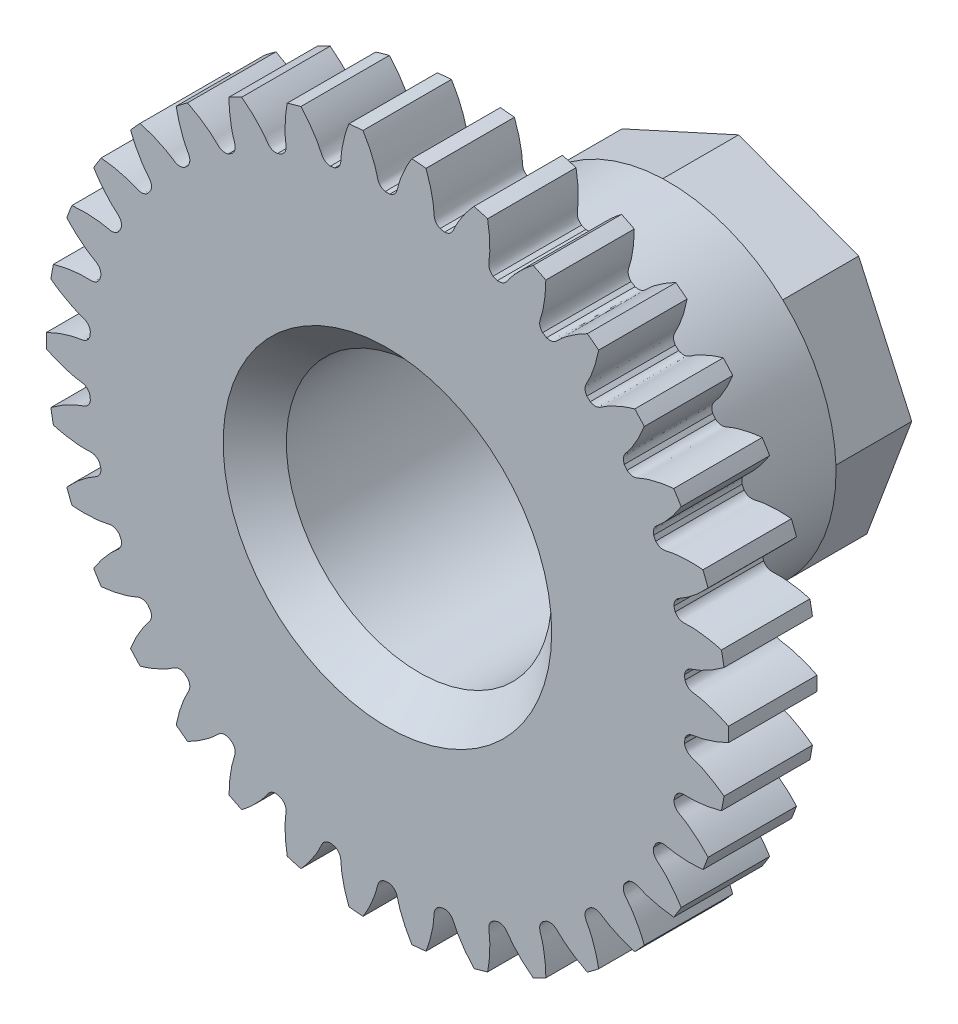
from build123d import *

# Parameters (mm, degrees)
SKETCH_1_R               = 27
EXTRUDE_1_DEPTH          = 7
CUT_EXTRUDE_1_DEPTH      = 39.820097888
PATTERN_CIRCULAR_1_COUNT = 34
EXTRUDE_START            = -7
SKETCH_5_R               = 21
EXTRUDE_2_DEPTH          = 1
SKETCH_4_R               = 10.5
CUT_EXTRUDE_2_DEPTH      = 39.964927539
CHAMFER_1_SIZE           = 2.5
EXTRUDE_START_2          = -8
SKETCH_6_R               = 13.25
SKETCH_6_R_2             = 10.5
EXTRUDE_3_DEPTH          = 20.25
CHAMFER_2_SIZE           = 3
SKETCH_7_OUTSIDE_W       = 72.266
SKETCH_7_OUTSIDE_H       = 72.128
CUT_EXTRUDE_3_DEPTH      = 6


with BuildPart() as part:
    # 草图1 → 凸台-拉伸1 (new body)
    with BuildSketch(Plane.XY):
        Circle(SKETCH_1_R)
    extrude(amount=EXTRUDE_1_DEPTH)

    # 草图2 → 切除-拉伸1 (cut, through all)
    with BuildSketch(Plane.XY):
        with BuildLine():
            ThreePointArc((0.183171175, 23.624289901), (0, 23.625), (-0.183171175, 23.624289901))
            add(Edge.make_bspline(
                [(-0.183171175, 23.624289901), (-0.716587806, 23.775112896), (-0.763410395, 24.188787315), (-0.879946356, 24.623629896), (-0.912930358, 24.738245821), (-0.951084244, 24.861314333), (-0.99469329, 24.992699977), (-1.044123655, 25.132221413), (-1.099711127, 25.279697341), (-1.161793992, 25.434932943), (-1.230702926, 25.597724076), (-1.306763614, 25.76785621), (-1.390295632, 25.945104927), (-1.481612426, 26.129235971), (-1.581020975, 26.320005435), (-1.688821555, 26.51715992), (-1.805307471, 26.720436707), (-1.930764813, 26.929563939), (-2.065472203, 27.144260803), (-2.209700557, 27.364237722), (-2.36371284, 27.589196551), (-2.527763841, 27.818830783), (-2.702099938, 28.052825758), (-2.886958877, 28.290858874), (-3.082569553, 28.532599812), (-3.289151799, 28.777710761), (-3.506916179, 29.025846649), (-3.73606378, 29.276655378), (-3.97678604, 29.52977807), (-4.229264468, 29.784849315), (-4.586391615, 30.131497572), (-4.865591808, 30.386500811), (-5.057363345, 30.554916542)],
                knots=[0, 0, 0, 0, 0.13072362, 0.143503881, 0.157401081, 0.17241522, 0.188546299, 0.205794316, 0.224159273, 0.243641169, 0.264240005, 0.285955779, 0.308788493, 0.332738146, 0.357804738, 0.383988269, 0.411288739, 0.439706149, 0.469240498, 0.499891786, 0.531660014, 0.56454518, 0.598547286, 0.633666331, 0.669902315, 0.707255238, 0.745725101, 0.785311903, 0.826015644, 0.867836324, 0.910773943, 1, 1, 1, 1], degree=3))
            ThreePointArc((-5.057363345, 30.554916542), (0, 30.970628811), (5.057363345, 30.554916542))
            add(Edge.make_bspline(
                [(0.183171175, 23.624289901), (0.716587806, 23.775112896), (0.763410395, 24.188787315), (0.879946356, 24.623629896), (0.912930358, 24.738245821), (0.951084244, 24.861314333), (0.99469329, 24.992699977), (1.044123655, 25.132221413), (1.099711127, 25.279697341), (1.161793992, 25.434932943), (1.230702926, 25.597724076), (1.306763614, 25.76785621), (1.390295632, 25.945104927), (1.481612426, 26.129235971), (1.581020975, 26.320005435), (1.688821555, 26.51715992), (1.805307471, 26.720436707), (1.930764813, 26.929563939), (2.065472203, 27.144260803), (2.209700557, 27.364237722), (2.36371284, 27.589196551), (2.527763841, 27.818830783), (2.702099938, 28.052825758), (2.886958877, 28.290858874), (3.082569553, 28.532599812), (3.289151799, 28.777710761), (3.506916179, 29.025846649), (3.73606378, 29.276655378), (3.97678604, 29.52977807), (4.229264468, 29.784849315), (4.586391615, 30.131497572), (4.865591808, 30.386500811), (5.057363345, 30.554916542)],
                knots=[0, 0, 0, 0, 0.13072362, 0.143503881, 0.157401081, 0.17241522, 0.188546299, 0.205794316, 0.224159273, 0.243641169, 0.264240005, 0.285955779, 0.308788493, 0.332738146, 0.357804738, 0.383988269, 0.411288739, 0.439706149, 0.469240498, 0.499891786, 0.531660014, 0.56454518, 0.598547286, 0.633666331, 0.669902315, 0.707255238, 0.745725101, 0.785311903, 0.826015644, 0.867836324, 0.910773943, 1, 1, 1, 1], degree=3))
        make_face()
    cut_extrude_1 = extrude(amount=CUT_EXTRUDE_1_DEPTH, mode=Mode.SUBTRACT)

    # 阵列(圆周)1: 切除-拉伸1 ×34 about axis
    pattern_circular_1_axis = Axis((0, 0, -1.5), (0, 0, 1))
    for i in range(1, PATTERN_CIRCULAR_1_COUNT):
        add(cut_extrude_1.rotate(pattern_circular_1_axis, i * 360 / PATTERN_CIRCULAR_1_COUNT), mode=Mode.SUBTRACT)

    # 草图5 → 凸台-拉伸2 (add)
    with BuildSketch(Plane.XY.offset(7).offset(EXTRUDE_START)):
        Circle(SKETCH_5_R)
    extrude(amount=-EXTRUDE_2_DEPTH)

    # 草图4 → 切除-拉伸2 (cut, through all)
    with BuildSketch(Plane.XY.offset(7)):
        Circle(SKETCH_4_R)
    extrude(amount=-CUT_EXTRUDE_2_DEPTH, mode=Mode.SUBTRACT)

    # 倒角1
    chamfer_1_edges = [part.edges().sort_by_distance(p)[0] for p in [
        (-10.5, 0, 7),
    ]]
    chamfer(chamfer_1_edges, length=CHAMFER_1_SIZE)

    # 草图6 → 凸台-拉伸3 (add)
    with BuildSketch(Plane.XY.offset(7).offset(EXTRUDE_START_2)):
        Circle(SKETCH_6_R)
        Circle(SKETCH_6_R_2, mode=Mode.SUBTRACT)
    extrude(amount=-EXTRUDE_3_DEPTH)

    # 倒角2
    chamfer_2_edges = [part.edges().sort_by_distance(p)[0] for p in [
        (-13.25, 0, -1),
    ]]
    chamfer(chamfer_2_edges, length=CHAMFER_2_SIZE)

    # 草图7 outside → 切除-拉伸3 (cut)
    with BuildSketch(Plane(origin=(0, 0, -21.25), x_dir=(-1, 0, 0), z_dir=(0, 0, -1))):
        Rectangle(SKETCH_7_OUTSIDE_W, SKETCH_7_OUTSIDE_H)
        Polygon((0.457352152, 13.242104403), (-9.040185012, 9.686978628), (-13.242104403, 0.457352152), (-9.686978628, -9.040185012), (-0.457352152, -13.242104403), (9.040185012, -9.686978628), (13.242104403, -0.457352152), (9.686978628, 9.040185012), align=None, mode=Mode.SUBTRACT)
    extrude(amount=-CUT_EXTRUDE_3_DEPTH, mode=Mode.SUBTRACT)


solid = part.part
